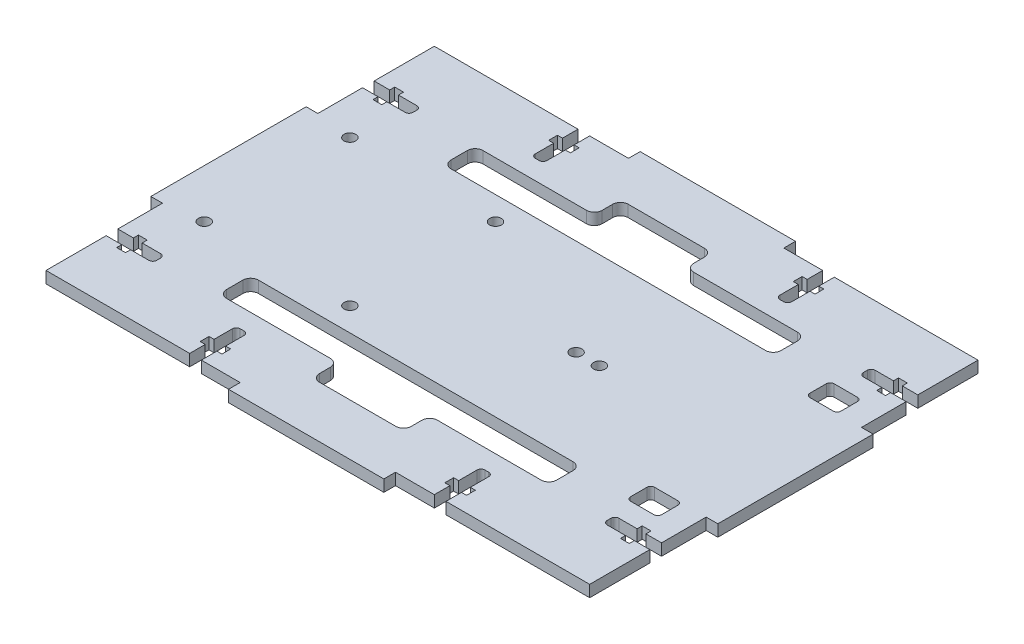
from build123d import *

# Parameters (mm, degrees)
ESBO_O1_W                  = 140
ESBO_O1_H                  = 100
RESSALTO_EXTRUS_O1_DEPTH   = 1.5
ESBO_O4_W                  = 3
ESBO_O4_H                  = 40
ESBO_O4_W_2                = 40
ESBO_O4_H_2                = 3
RESSALTO_EXTRUS_O2_DEPTH   = 3
CORTE_EXTRUS_O1_DEPTH      = 91.260733434
CORTE_EXTRUS_O4_DEPTH      = 91.260733434
CORTE_EXTRUS_O8_DEPTH      = 91.260733434
CORTE_EXTRUS_O8_DEPTH_BACK = 91.260733434
ESBO_O13_R                 = 1.5
CUT_EXTRUDE2_DEPTH         = 91.260733434
CUT_EXTRUDE2_DEPTH_BACK    = 91.260733434
SKETCH3_R                  = 1.5
CUT_EXTRUDE3_DEPTH         = 91.223334011
CUT_EXTRUDE3_DEPTH_BACK    = 91.223334011


with BuildPart() as part:
    # Esboço1 → Ressalto-extrusão1 (new, symmetric)
    with BuildSketch(Plane(origin=(0, 0, 0), x_dir=(1, 0, 0), z_dir=(0, 1, 0))):
        Rectangle(ESBO_O1_W, ESBO_O1_H)
    extrude(amount=RESSALTO_EXTRUS_O1_DEPTH, both=True)

    # Esboço4 → Ressalto-extrusão2 (add, through all)
    with BuildSketch(Plane(origin=(0, 1.5, 0), x_dir=(1, 0, 0), z_dir=(0, 1, 0))):
        with Locations((-71.5, 0)):
            Rectangle(ESBO_O4_W, ESBO_O4_H)
        with Locations((0, 51.5)):
            Rectangle(ESBO_O4_W_2, ESBO_O4_H_2)
        with Locations((0, -51.5)):
            Rectangle(ESBO_O4_W_2, ESBO_O4_H_2)
        with Locations((71.5, 0)):
            Rectangle(ESBO_O4_W, ESBO_O4_H)
    extrude(amount=-RESSALTO_EXTRUS_O2_DEPTH)

    # Esboço2 → Corte-extrusão1 (cut, through all)
    with BuildSketch(Plane(origin=(0, 1.5, 0), x_dir=(1, 0, 0), z_dir=(0, 1, 0))):
        with BuildLine():
            Line((-33, -43.73), (-33, -39))
            ThreePointArc((-33, -39), (-32.707106781, -38.292893219), (-32, -38))
            Line((-32, -38), (-31, -38))
            ThreePointArc((-31, -38), (-30.292893219, -38.292893219), (-30, -39))
            Line((-30, -39), (-30, -43.73))
            Line((-30, -43.73), (-28.7, -43.73))
            Line((-28.7, -43.73), (-28.7, -46))
            Line((-28.7, -46), (-30, -46))
            Line((-30, -46), (-30, -50))
            Line((-30, -50), (-33, -50))
            Line((-33, -50), (-33, -46))
            Line((-33, -46), (-34.3, -46))
            Line((-34.3, -46), (-34.3, -43.73))
            Line((-34.3, -43.73), (-33, -43.73))
        make_face()
        with BuildLine():
            Line((-28.7, 46), (-28.7, 43.73))
            Line((-28.7, 43.73), (-30, 43.73))
            Line((-30, 43.73), (-30, 39))
            ThreePointArc((-30, 39), (-30.292893219, 38.292893219), (-31, 38))
            Line((-31, 38), (-32, 38))
            ThreePointArc((-32, 38), (-32.707106781, 38.292893219), (-33, 39))
            Line((-33, 39), (-33, 43.73))
            Line((-33, 43.73), (-34.3, 43.73))
            Line((-34.3, 43.73), (-34.3, 46))
            Line((-34.3, 46), (-33, 46))
            Line((-33, 46), (-33, 50))
            Line((-33, 50), (-30, 50))
            Line((-30, 50), (-30, 46))
            Line((-30, 46), (-28.7, 46))
        make_face()
        with BuildLine():
            Line((33, 43.73), (33, 39))
            ThreePointArc((33, 39), (32.707106781, 38.292893219), (32, 38))
            Line((32, 38), (31, 38))
            ThreePointArc((31, 38), (30.292893219, 38.292893219), (30, 39))
            Line((30, 39), (30, 43.73))
            Line((30, 43.73), (28.7, 43.73))
            Line((28.7, 43.73), (28.7, 46))
            Line((28.7, 46), (30, 46))
            Line((30, 46), (30, 50))
            Line((30, 50), (33, 50))
            Line((33, 50), (33, 46))
            Line((33, 46), (34.3, 46))
            Line((34.3, 46), (34.3, 43.73))
            Line((34.3, 43.73), (33, 43.73))
        make_face()
        with BuildLine():
            Line((28.7, -46), (28.7, -43.73))
            Line((28.7, -43.73), (30, -43.73))
            Line((30, -43.73), (30, -39))
            ThreePointArc((30, -39), (30.292893219, -38.292893219), (31, -38))
            Line((31, -38), (32, -38))
            ThreePointArc((32, -38), (32.707106781, -38.292893219), (33, -39))
            Line((33, -39), (33, -43.73))
            Line((33, -43.73), (34.3, -43.73))
            Line((34.3, -43.73), (34.3, -46))
            Line((34.3, -46), (33, -46))
            Line((33, -46), (33, -50))
            Line((33, -50), (30, -50))
            Line((30, -50), (30, -46))
            Line((30, -46), (28.7, -46))
        make_face()
    extrude(amount=-CORTE_EXTRUS_O1_DEPTH, mode=Mode.SUBTRACT)

    # Esboço7 → Corte-extrusão4 (cut, through all)
    with BuildSketch(Plane(origin=(0, 1.5, 0), x_dir=(1, 0, 0), z_dir=(0, 1, 0))):
        with BuildLine():
            Line((-70, -31.5), (-66, -31.5))
            Line((-66, -31.5), (-66, -30.2))
            Line((-66, -30.2), (-63.73, -30.2))
            Line((-63.73, -30.2), (-63.73, -31.5))
            Line((-63.73, -31.5), (-59, -31.5))
            ThreePointArc((-59, -31.5), (-58.292893219, -31.792893219), (-58, -32.5))
            Line((-58, -32.5), (-58, -33.5))
            ThreePointArc((-58, -33.5), (-58.292893219, -34.207106781), (-59, -34.5))
            Line((-59, -34.5), (-63.73, -34.5))
            Line((-63.73, -34.5), (-63.73, -35.8))
            Line((-63.73, -35.8), (-66, -35.8))
            Line((-66, -35.8), (-66, -34.5))
            Line((-66, -34.5), (-70, -34.5))
            Line((-70, -34.5), (-70, -31.5))
        make_face()
        with BuildLine():
            Line((66, -34.5), (66, -35.8))
            Line((66, -35.8), (63.73, -35.8))
            Line((63.73, -35.8), (63.73, -34.5))
            Line((63.73, -34.5), (59, -34.5))
            ThreePointArc((59, -34.5), (58.292893219, -34.207106781), (58, -33.5))
            Line((58, -33.5), (58, -32.5))
            ThreePointArc((58, -32.5), (58.292893219, -31.792893219), (59, -31.5))
            Line((59, -31.5), (63.73, -31.5))
            Line((63.73, -31.5), (63.73, -30.2))
            Line((63.73, -30.2), (66, -30.2))
            Line((66, -30.2), (66, -31.5))
            Line((66, -31.5), (70, -31.5))
            Line((70, -31.5), (70, -34.5))
            Line((70, -34.5), (66, -34.5))
        make_face()
        with BuildLine():
            Line((70, 31.5), (66, 31.5))
            Line((66, 31.5), (66, 30.2))
            Line((66, 30.2), (63.73, 30.2))
            Line((63.73, 30.2), (63.73, 31.5))
            Line((63.73, 31.5), (59, 31.5))
            ThreePointArc((59, 31.5), (58.292893219, 31.792893219), (58, 32.5))
            Line((58, 32.5), (58, 33.5))
            ThreePointArc((58, 33.5), (58.292893219, 34.207106781), (59, 34.5))
            Line((59, 34.5), (63.73, 34.5))
            Line((63.73, 34.5), (63.73, 35.8))
            Line((63.73, 35.8), (66, 35.8))
            Line((66, 35.8), (66, 34.5))
            Line((66, 34.5), (70, 34.5))
            Line((70, 34.5), (70, 31.5))
        make_face()
        with BuildLine():
            Line((-66, 34.5), (-66, 35.8))
            Line((-66, 35.8), (-63.73, 35.8))
            Line((-63.73, 35.8), (-63.73, 34.5))
            Line((-63.73, 34.5), (-59, 34.5))
            ThreePointArc((-59, 34.5), (-58.292893219, 34.207106781), (-58, 33.5))
            Line((-58, 33.5), (-58, 32.5))
            ThreePointArc((-58, 32.5), (-58.292893219, 31.792893219), (-59, 31.5))
            Line((-59, 31.5), (-63.73, 31.5))
            Line((-63.73, 31.5), (-63.73, 30.2))
            Line((-63.73, 30.2), (-66, 30.2))
            Line((-66, 30.2), (-66, 31.5))
            Line((-66, 31.5), (-70, 31.5))
            Line((-70, 31.5), (-70, 34.5))
            Line((-70, 34.5), (-66, 34.5))
        make_face()
    extrude(amount=-CORTE_EXTRUS_O4_DEPTH, mode=Mode.SUBTRACT)

    # Esboço13 → Corte-extrusão8 (cut, two sides: drawn at the far end of the back side and taken through both)
    with BuildSketch(Plane(origin=(0, -1.5, 0), x_dir=(-1, 0, 0), z_dir=(0, -1, 0)).offset(-CORTE_EXTRUS_O8_DEPTH_BACK)):
        with Locations(Location((60.5, -18.75, 0), (0, 0, 90))):
            Circle(ESBO_O13_R)
        with Locations(Location((23, -18.75, 0), (0, 0, 90))):
            Circle(ESBO_O13_R)
        with Locations(Location((60.5, 18.75, 0), (0, 0, 90))):
            Circle(ESBO_O13_R)
        with Locations(Location((23, 18.75, 0), (0, 0, 90))):
            Circle(ESBO_O13_R)
    extrude(amount=CORTE_EXTRUS_O8_DEPTH + CORTE_EXTRUS_O8_DEPTH_BACK, mode=Mode.SUBTRACT)

    # Sketch3 → Cut-Extrude2 (cut, two sides: drawn at the far end of the back side and taken through both)
    with BuildSketch(Plane(origin=(0, 1.5, 0), x_dir=(1, 0, 0), z_dir=(0, 1, 0)).offset(-CUT_EXTRUDE2_DEPTH_BACK)):
        with Locations(Location((16.5, 0, 0), (0, 0, 270))):
            Circle(SKETCH3_R)
        with Locations(Location((22.5, 0, 0), (0, 0, 270))):
            Circle(SKETCH3_R)
    extrude(amount=CUT_EXTRUDE2_DEPTH + CUT_EXTRUDE2_DEPTH_BACK, mode=Mode.SUBTRACT)

    # Sketch4 → Cut-Extrude3 (cut, two sides: drawn at the far end of the back side and taken through both)
    with BuildSketch(Plane(origin=(0, 0, 0), x_dir=(1, 0, 0), z_dir=(0, 1, 0)).offset(-CUT_EXTRUDE3_DEPTH_BACK)):
        with BuildLine():
            Line((-40.5, 33), (-13.8, 33))
            ThreePointArc((-13.8, 33), (-12.385786438, 33.585786438), (-11.8, 35))
            Line((-11.8, 35), (-11.8, 37.73))
            ThreePointArc((-11.8, 37.73), (-11.214213562, 39.144213562), (-9.8, 39.73))
            Line((-9.8, 39.73), (9.8, 39.73))
            ThreePointArc((9.8, 39.73), (11.214213562, 39.144213562), (11.8, 37.73))
            Line((11.8, 37.73), (11.8, 35))
            ThreePointArc((11.8, 35), (12.385786438, 33.585786438), (13.8, 33))
            Line((13.8, 33), (40.5, 33))
            ThreePointArc((40.5, 33), (41.914213562, 32.414213562), (42.5, 31))
            Line((42.5, 31), (42.5, 26.8))
            ThreePointArc((42.5, 26.8), (41.914213562, 25.385786438), (40.5, 24.8))
            Line((40.5, 24.8), (-40.5, 24.8))
            ThreePointArc((-40.5, 24.8), (-41.914213562, 25.385786438), (-42.5, 26.8))
            Line((-42.5, 26.8), (-42.5, 31))
            ThreePointArc((-42.5, 31), (-41.914213562, 32.414213562), (-40.5, 33))
        make_face()
        with BuildLine():
            Line((13.8, -33), (40.5, -33))
            ThreePointArc((40.5, -33), (41.914213562, -32.414213562), (42.5, -31))
            Line((42.5, -31), (42.5, -26.8))
            ThreePointArc((42.5, -26.8), (41.914213562, -25.385786438), (40.5, -24.8))
            Line((40.5, -24.8), (-40.5, -24.8))
            ThreePointArc((-40.5, -24.8), (-41.914213562, -25.385786438), (-42.5, -26.8))
            Line((-42.5, -26.8), (-42.5, -31))
            ThreePointArc((-42.5, -31), (-41.914213562, -32.414213562), (-40.5, -33))
            Line((-40.5, -33), (-13.8, -33))
            ThreePointArc((-13.8, -33), (-12.385786438, -33.585786438), (-11.8, -35))
            Line((-11.8, -35), (-11.8, -37.73))
            ThreePointArc((-11.8, -37.73), (-11.214213562, -39.144213562), (-9.8, -39.73))
            Line((-9.8, -39.73), (9.8, -39.73))
            ThreePointArc((9.8, -39.73), (11.214213562, -39.144213562), (11.8, -37.73))
            Line((11.8, -37.73), (11.8, -35))
            ThreePointArc((11.8, -35), (12.385786438, -33.585786438), (13.8, -33))
        make_face()
        with BuildLine():
            Line((56.73, 26.2), (62.73, 26.2))
            ThreePointArc((62.73, 26.2), (63.437106781, 25.907106781), (63.73, 25.2))
            Line((63.73, 25.2), (63.73, 21))
            ThreePointArc((63.73, 21), (63.437106781, 20.292893219), (62.73, 20))
            Line((62.73, 20), (56.73, 20))
            ThreePointArc((56.73, 20), (56.022893219, 20.292893219), (55.73, 21))
            Line((55.73, 21), (55.73, 25.2))
            ThreePointArc((55.73, 25.2), (56.022893219, 25.907106781), (56.73, 26.2))
        make_face()
        with BuildLine():
            Line((63.73, -25.2), (63.73, -21))
            ThreePointArc((63.73, -21), (63.437106781, -20.292893219), (62.73, -20))
            Line((62.73, -20), (56.73, -20))
            ThreePointArc((56.73, -20), (56.022893219, -20.292893219), (55.73, -21))
            Line((55.73, -21), (55.73, -25.2))
            ThreePointArc((55.73, -25.2), (56.022893219, -25.907106781), (56.73, -26.2))
            Line((56.73, -26.2), (62.73, -26.2))
            ThreePointArc((62.73, -26.2), (63.437106781, -25.907106781), (63.73, -25.2))
        make_face()
    extrude(amount=CUT_EXTRUDE3_DEPTH + CUT_EXTRUDE3_DEPTH_BACK, mode=Mode.SUBTRACT)


solid = part.part
